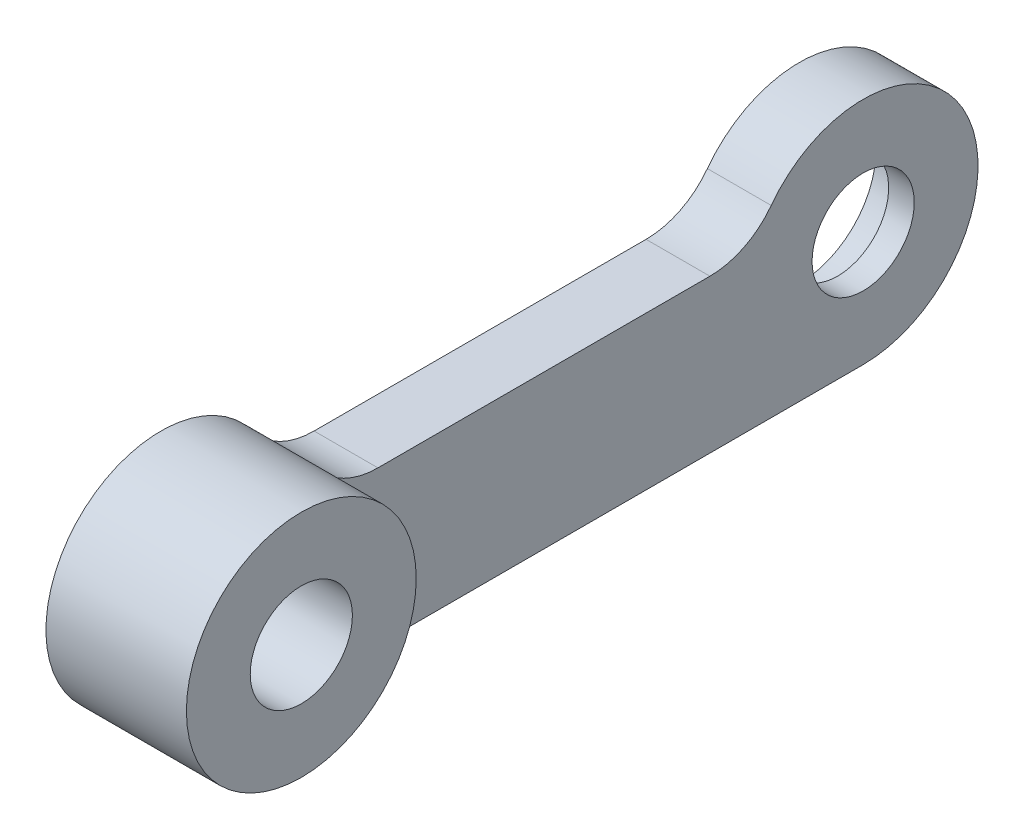
from build123d import *

# Parameters (mm, degrees)
SKETCH_1_R               = 4.5
SKETCH_1_W               = 25
SKETCH_1_H               = 6
EXTRUDE_1_DEPTH          = 2.5
EXTRUDE_START            = 2.5
SKETCH_1_5_R             = 4.5
EXTRUDE_3_DEPTH          = 3
CUT_EXTRUDE_2_DEPTH      = 31.602287496
CUT_EXTRUDE_2_DEPTH_BACK = 31.602287496
SKETCH_1_4_R             = 2
FILLET_1_R               = 3
SKETCH_2_R               = 3
CUT_EXTRUDE_3_DEPTH      = 1.5


with BuildPart() as part:
    # 草图1 → 凸台-拉伸1 (new body)
    with BuildSketch(Plane(origin=(0, 0, 0), x_dir=(0, 0, -1), z_dir=(1, 0, 0))):
        with Locations((0, -1.5)):
            Circle(SKETCH_1_R)
        with Locations((25, -1.5)):
            Circle(SKETCH_1_R)
        with Locations((12.5, -3)):
            Rectangle(SKETCH_1_W, SKETCH_1_H)
    extrude(amount=EXTRUDE_1_DEPTH)

    # 草图1<5> → 凸台-拉伸3 (add)
    with BuildSketch(Plane(origin=(0, 0, 0), x_dir=(0, 0, -1), z_dir=(1, 0, 0)).offset(EXTRUDE_START)):
        with Locations(Location((0, -1.5, 0), (0, 0, 270))):
            Circle(SKETCH_1_5_R)
    extrude(amount=EXTRUDE_3_DEPTH)

    # 草图1<4> → 切除-拉伸2 (cut, two sides: drawn at the far end of the back side and taken through both)
    with BuildSketch(Plane(origin=(0, 0, 0), x_dir=(0, 0, -1), z_dir=(1, 0, 0)).offset(-CUT_EXTRUDE_2_DEPTH_BACK)):
        with Locations((0, -1.5)):
            Circle(SKETCH_1_4_R)
        with Locations((25, -1.5)):
            Circle(SKETCH_1_4_R)
    extrude(amount=CUT_EXTRUDE_2_DEPTH + CUT_EXTRUDE_2_DEPTH_BACK, mode=Mode.SUBTRACT)

    # 圆角1
    fillet_1_edges = [part.edges().sort_by_distance(p)[0] for p in [
        (1.25, 0, -20.757359313),
        (1.25, 0, -4.242640687),
    ]]
    fillet(fillet_1_edges, radius=FILLET_1_R)

    # 草图2 → 切除-拉伸3 (cut)
    with BuildSketch(Plane.ZY):
        with Locations((-25, -1.5)):
            Circle(SKETCH_2_R)
        with Locations((0, -1.5)):
            Circle(SKETCH_2_R)
    extrude(amount=-CUT_EXTRUDE_3_DEPTH, mode=Mode.SUBTRACT)


solid = part.part
